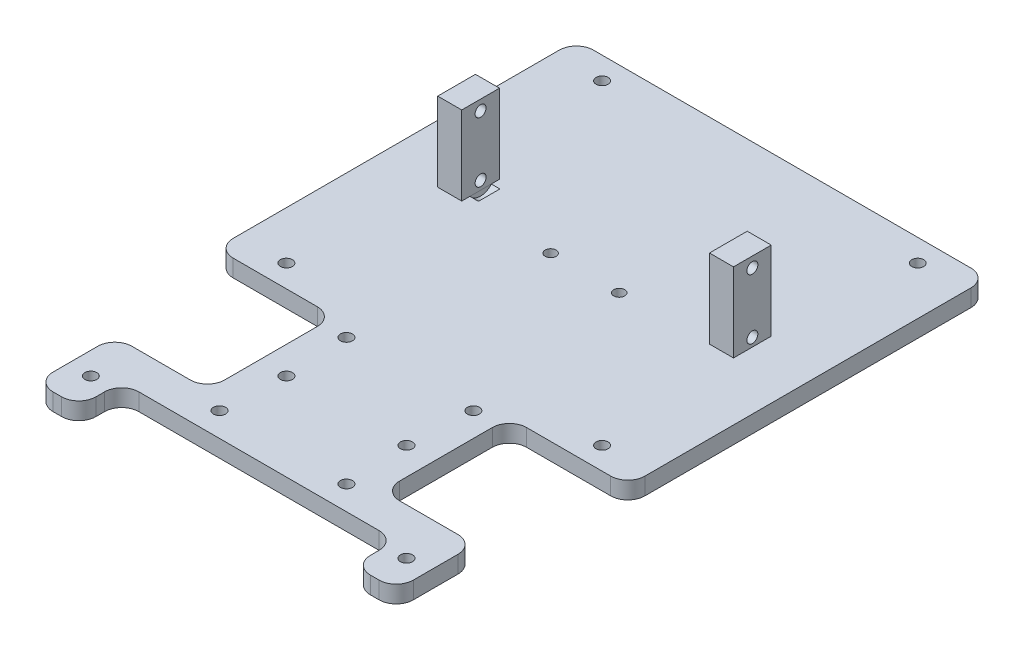
from build123d import *

# Parameters (mm, degrees)
EXTRUDE_1_DEPTH             = 5
SKETCH_2_W                  = 7
SKETCH_2_H                  = 11
EXTRUDE_2_DEPTH             = 23
SKETCH_3_R                  = 1.6
CUT_EXTRUDE_1_DEPTH         = 151.583730861
SKETCH_5_R                  = 1.75
CUT_EXTRUDE_1417_DEPTH      = 130.557902113
SKETCH2_R                   = 4
CUT_EXTRUDE1_DEPTH          = 2.5
CUT_EXTRUDE2_START          = 2.5
SKETCH3_R                   = 4
CUT_EXTRUDE2_DEPTH          = 2.5
CUT_EXTRUDE_2298_DEPTH      = 130.557902113
CUT_EXTRUDE_2298_DEPTH_BACK = 130.557902113
SKETCH4_R                   = 1.6
SKETCH6_R                   = 1.75
CUT_EXTRUDE_2672_DEPTH      = 130.557902113
SKETCH7_R                   = 1.75
CUT_EXTRUDE_3081_DEPTH      = 130.557902113
SKETCH9_R                   = 1.75
CUT_EXTRUDE_3619_DEPTH      = 130.557902113
SKETCH8_W                   = 80
SKETCH8_H                   = 25
CUT_EXTRUDE7_DEPTH          = 130.557902113
FILLET_1_R                  = 5
SKETCH10_W                  = 27
SKETCH10_H                  = 37
CUT_EXTRUDE8_DEPTH          = 130.557902113
FILLET3_R                   = 5


with BuildPart() as part:
    # 스케치1 → 보스-돌출1 (new body)
    with BuildSketch(Plane(origin=(0, 0, 0), x_dir=(1, 0, 0), z_dir=(0, 1, 0))):
        Polygon((-52.5, -52.5), (-60, -52.5), (-60, 52.5), (60, 52.5), (60, -52.5), (52.5, -52.5), (52.5, -112.5), (-52.5, -112.5), align=None)
    extrude(amount=EXTRUDE_1_DEPTH)

    # 스케치5 → Cut-Extrude 1417 (cut, through all)
    with BuildSketch(Plane(origin=(0, 5, 0), x_dir=(1, 0, 0), z_dir=(0, 1, 0))):
        with Locations(Location((-46, -46, 0), (0, 0, 270))):
            Circle(SKETCH_5_R)
        with Locations(Location((-46, 46, 0), (0, 0, 270))):
            Circle(SKETCH_5_R)
        with Locations(Location((46, 46, 0), (0, 0, 270))):
            Circle(SKETCH_5_R)
        with Locations(Location((46, -46, 0), (0, 0, 270))):
            Circle(SKETCH_5_R)
    extrude(amount=-CUT_EXTRUDE_1417_DEPTH, mode=Mode.SUBTRACT)

    # Sketch2 → Cut-Extrude1 (cut)
    with BuildSketch(Plane.ZY.offset(-36.1)):
        with Locations((-0.7, 7.5)):
            Circle(SKETCH2_R)
    extrude(amount=CUT_EXTRUDE1_DEPTH, mode=Mode.SUBTRACT)

    # Sketch3 → Cut-Extrude2 (cut)
    with BuildSketch(Plane(origin=(-36.1, 0, 0), x_dir=(0, 0, -1), z_dir=(1, 0, 0)).offset(CUT_EXTRUDE2_START)):
        with Locations((0.7, 7.5)):
            Circle(SKETCH3_R)
    extrude(amount=-CUT_EXTRUDE2_DEPTH, mode=Mode.SUBTRACT)

    # Sketch4 → Cut-Extrude 2298 (cut, two sides: drawn at the far end of the back side and taken through both)
    with BuildSketch(Plane(origin=(0, 5, 0), x_dir=(1, 0, 0), z_dir=(0, 1, 0)).offset(-CUT_EXTRUDE_2298_DEPTH_BACK)):
        with Locations(Location((-10, -5, 0), (0, 0, 270))):
            Circle(SKETCH4_R)
        with Locations(Location((10, -5, 0), (0, 0, 270))):
            Circle(SKETCH4_R)
    extrude(amount=CUT_EXTRUDE_2298_DEPTH + CUT_EXTRUDE_2298_DEPTH_BACK, mode=Mode.SUBTRACT)

    # Sketch6 → Cut-Extrude 2672 (cut, through all)
    with BuildSketch(Plane(origin=(0, 5, 0), x_dir=(1, 0, 0), z_dir=(0, 1, 0))):
        with Locations(Location((-18.5, -93, 0), (0, 0, 270))):
            Circle(SKETCH6_R)
        with Locations(Location((-18.5, -56, 0), (0, 0, 270))):
            Circle(SKETCH6_R)
        with Locations(Location((18.5, -56, 0), (0, 0, 270))):
            Circle(SKETCH6_R)
        with Locations(Location((18.5, -93, 0), (0, 0, 270))):
            Circle(SKETCH6_R)
    extrude(amount=-CUT_EXTRUDE_2672_DEPTH, mode=Mode.SUBTRACT)

    # Sketch7 → Cut-Extrude 3081 (cut, through all)
    with BuildSketch(Plane(origin=(0, 5, 0), x_dir=(1, 0, 0), z_dir=(0, 1, 0))):
        with Locations(Location((-46, -103, 0), (0, 0, 270))):
            Circle(SKETCH7_R)
        with Locations(Location((46, -103, 0), (0, 0, 270))):
            Circle(SKETCH7_R)
    extrude(amount=-CUT_EXTRUDE_3081_DEPTH, mode=Mode.SUBTRACT)

    # Sketch9 → Cut-Extrude 3619 (cut, through all)
    with BuildSketch(Plane(origin=(0, 5, 0), x_dir=(1, 0, 0), z_dir=(0, 1, 0))):
        with Locations(Location((-17.5, -74.5, 0), (0, 0, 270))):
            Circle(SKETCH9_R)
        with Locations(Location((17.5, -74.5, 0), (0, 0, 270))):
            Circle(SKETCH9_R)
    extrude(amount=-CUT_EXTRUDE_3619_DEPTH, mode=Mode.SUBTRACT)

    # Sketch8 → Cut-Extrude7 (cut, through all)
    with BuildSketch(Plane(origin=(0, 5, 0), x_dir=(1, 0, 0), z_dir=(0, 1, 0))):
        with Locations((0, -112.5)):
            Rectangle(SKETCH8_W, SKETCH8_H)
    extrude(amount=-CUT_EXTRUDE7_DEPTH, mode=Mode.SUBTRACT)

    # 필렛1
    fillet_1_edges = [part.edges().sort_by_distance(p)[0] for p in [
        (40, 2.5, 112.5),
        (40, 2.5, 100),
        (-40, 2.5, 112.5),
        (-40, 2.5, 100),
        (-60, 2.5, -52.5),
        (60, 2.5, -52.5),
        (52.5, 2.5, 112.5),
        (-52.5, 2.5, 112.5),
    ]]
    fillet(fillet_1_edges, radius=FILLET_1_R)

    # Sketch10 → Cut-Extrude8 (cut, through all)
    with BuildSketch(Plane(origin=(0, 5, 0), x_dir=(1, 0, 0), z_dir=(0, 1, 0))):
        with Locations((-39, -71)):
            Rectangle(SKETCH10_W, SKETCH10_H)
        with Locations((39, -71)):
            Rectangle(SKETCH10_W, SKETCH10_H)
    extrude(amount=-CUT_EXTRUDE8_DEPTH, mode=Mode.SUBTRACT)

    # Fillet3
    fillet3_edges = [part.edges().sort_by_distance(p)[0] for p in [
        (60, 2.5, 52.5),
        (-60, 2.5, 52.5),
        (-52.5, 2.5, 89.5),
        (-25.5, 2.5, 52.5),
        (-25.5, 2.5, 89.5),
        (25.5, 2.5, 52.5),
        (52.5, 2.5, 89.5),
        (25.5, 2.5, 89.5),
    ]]
    fillet(fillet3_edges, radius=FILLET3_R)


with BuildPart() as body_2:
    # 스케치2 → 보스-돌출2 (new body)
    with BuildSketch(Plane(origin=(0, 5, 0), x_dir=(1, 0, 0), z_dir=(0, 1, 0))):
        with Locations((-39.6, 0.7)):
            Rectangle(SKETCH_2_W, SKETCH_2_H)
    extrude(amount=EXTRUDE_2_DEPTH)

    # 스케치3 → 컷-돌출1 (cut, through all)
    with BuildSketch(Plane(origin=(-36.1, 0, 0), x_dir=(0, 0, -1), z_dir=(1, 0, 0))):
        with Locations((0.7, 25)):
            Circle(SKETCH_3_R)
        with Locations((0.7, 7.5)):
            Circle(SKETCH_3_R)
    extrude(amount=-CUT_EXTRUDE_1_DEPTH, mode=Mode.SUBTRACT)


with BuildPart() as body_3:
    # 대칭 복사1: mirrored copy
    add(body_2.part.mirror(Plane(origin=(0, 0, 0), x_dir=(0, 0, 1), z_dir=(1, 0, 0))))


solid = Compound([part.part, body_2.part, body_3.part])
